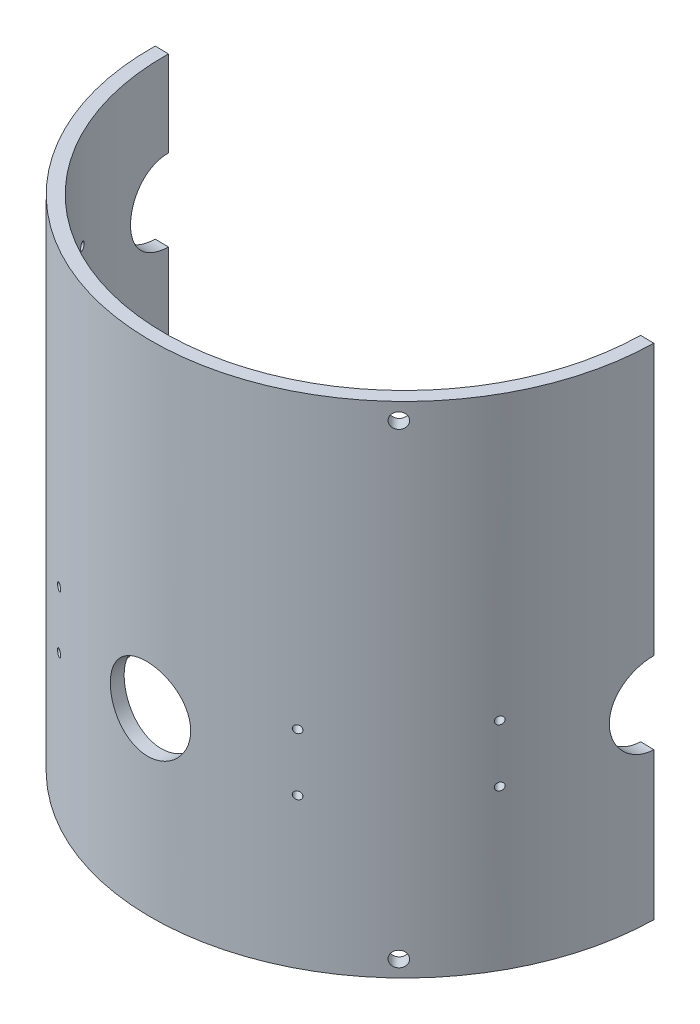
from build123d import *

# Parameters (mm, degrees)
BOSS_EXTRUDE1_DEPTH      = 130.8
SKETCH5_R                = 10.65
CUT_EXTRUDE4_DEPTH       = 129.8
SKETCH6_R                = 10.65
CUT_EXTRUDE5_DEPTH       = 129.8
SKETCH57_R               = 10.7
CUT_EXTRUDE48_DEPTH      = 148.089829044
CUT_EXTRUDE51_DEPTH      = 132.35522197
CUT_EXTRUDE51_DEPTH_BACK = 132.35522197
SKETCH60_R               = 2
CUT_EXTRUDE52_DEPTH      = 132.574432074
CUT_EXTRUDE52_DEPTH_BACK = 132.574432074
SKETCH61_R               = 2.000000001
SKETCH63_R               = 1
CUT_EXTRUDE53_DEPTH      = 155.429604817
SKETCH64_R               = 1
CUT_EXTRUDE54_DEPTH      = 157.678735431
SKETCH65_R               = 1
CUT_EXTRUDE55_DEPTH      = 157.678735431
SKETCH66_R               = 1
CUT_EXTRUDE56_DEPTH      = 155.429604817


with BuildPart() as part:
    # Sketch1 → Boss-Extrude1 (new body)
    with BuildSketch(Plane(origin=(0, 0, 0), x_dir=(0.999872775920664, 0, 0.01595092388251422), z_dir=(0, 1, 0))):
        with BuildLine():
            Line((70.372282363, 4.818066557), (66.856282363, 4.818066557))
            ThreePointArc((66.856282363, 4.818066557), (4.002282363, -58.035933443), (-58.851717637, 4.818066557))
            Line((-58.851717637, 4.818066557), (-62.367717637, 4.818066557))
            ThreePointArc((-62.367717637, 4.818066557), (4.002282363, -61.551933443), (70.372282363, 4.818066557))
        make_face()
    extrude(amount=BOSS_EXTRUDE1_DEPTH)

    # Sketch5 → Cut-Extrude4 (cut)
    with BuildSketch(Plane(origin=(63.687908888, 47.899932993, -8.621348971), x_dir=(0.015950923882504298, 0, -0.9998727759206641), z_dir=(0.9998727759206643, 0, 0.015950923882504298))):
        with Locations((-4.818066557, 1.350067007)):
            Circle(SKETCH5_R)
    extrude(amount=CUT_EXTRUDE4_DEPTH, mode=Mode.SUBTRACT)

    # Sketch6 → Cut-Extrude5 (cut)
    with BuildSketch(Plane(origin=(-55.376952084, 47.899932993, -10.520785159), x_dir=(-0.01595092388248271, 0, 0.9998727759206645), z_dir=(-0.9998727759206645, 0, -0.01595092388248271))):
        with Locations((4.818066557, 49.750067007)):
            Circle(SKETCH6_R)
    extrude(amount=CUT_EXTRUDE5_DEPTH, mode=Mode.SUBTRACT)

    # Sketch57 → Cut-Extrude48 (cut, through all)
    with BuildSketch(Plane(origin=(-1.337515808, 38.899932993, 83.841265458), x_dir=(0.999872775920664, 0, 0.015950923882512152), z_dir=(-0.015950923882512152, 0, 0.999872775920664))):
        with Locations((4.002282363, 7.900067007)):
            Circle(SKETCH57_R)
    extrude(amount=-CUT_EXTRUDE48_DEPTH, mode=Mode.SUBTRACT)

    # Sketch60 → Cut-Extrude51 (cut, two sides: drawn at the far end of the back side and taken through both)
    with BuildSketch(Plane(origin=(4.479542792, 38.899932993, -4.33978545), x_dir=(0.6958141043149662, 0, 0.7182219240850013), z_dir=(-0.7182219240850013, 0, 0.6958141043149662)).offset(-CUT_EXTRUDE51_DEPTH_BACK)):
        with Locations((-0.576184071, 87.550067007)):
            Circle(SKETCH60_R)
        with Locations((-0.576184071, -34.599932993)):
            Circle(SKETCH60_R)
    extrude(amount=CUT_EXTRUDE51_DEPTH + CUT_EXTRUDE51_DEPTH_BACK, mode=Mode.SUBTRACT)

    # Sketch61 → Cut-Extrude52 (cut, two sides: drawn at the far end of the back side and taken through both)
    with BuildSketch(Plane(origin=(-0.400917003, 38.899932993, -0.413828032), x_dir=(0.7182219240850013, 0, -0.6958141043149662), z_dir=(0.6958141043149662, 0, 0.7182219240850013)).offset(-CUT_EXTRUDE52_DEPTH_BACK)):
        with Locations((6.236989769, 87.550067007)):
            Circle(SKETCH61_R)
        with Locations((6.236989769, -34.599932997)):
            Circle(SKETCH61_R)
    extrude(amount=CUT_EXTRUDE52_DEPTH + CUT_EXTRUDE52_DEPTH_BACK, mode=Mode.SUBTRACT)

    # Sketch63 → Cut-Extrude53 (cut, through all)
    with BuildSketch(Plane(origin=(48.51495843, 38.899932993, 50.087966302), x_dir=(0.718295826620825, 0, -0.6957378137338129), z_dir=(0.6957378137338129, 0, 0.718295826620825))):
        with Locations((-12.551102324, 15.400067007)):
            Circle(SKETCH63_R)
        with Locations((-12.551102324, 0.400067007)):
            Circle(SKETCH63_R)
    extrude(amount=-CUT_EXTRUDE53_DEPTH, mode=Mode.SUBTRACT)

    # Sketch64 → Cut-Extrude54 (cut, through all)
    with BuildSketch(Plane(origin=(-46.022353024, 38.899932993, 44.577025355), x_dir=(0.6957378137337953, 0, 0.7182958266208421), z_dir=(-0.7182958266208421, 0, 0.6957378137337953))):
        with Locations((18.069559284, 15.400067007)):
            Circle(SKETCH64_R)
        with Locations((18.069559284, 0.400067007)):
            Circle(SKETCH64_R)
    extrude(amount=-CUT_EXTRUDE54_DEPTH, mode=Mode.SUBTRACT)

    # Sketch65 → Cut-Extrude55 (cut, through all)
    with BuildSketch(Plane(origin=(-46.022353024, 38.899932993, 44.577025355), x_dir=(0.6957378137338341, 0, 0.7182958266208045), z_dir=(-0.7182958266208045, 0, 0.6957378137338341))):
        with Locations((-19.364877393, 66.250067007)):
            Circle(SKETCH65_R)
        with Locations((-19.364877393, 51.250067007)):
            Circle(SKETCH65_R)
    extrude(amount=-CUT_EXTRUDE55_DEPTH, mode=Mode.SUBTRACT)

    # Sketch66 → Cut-Extrude56 (cut, through all)
    with BuildSketch(Plane(origin=(48.51495843, 38.899932993, 50.087966302), x_dir=(0.7182958266208437, 0, -0.6957378137337936), z_dir=(0.6957378137337936, 0, 0.7182958266208437))):
        with Locations((24.883334353, 17.850067007)):
            Circle(SKETCH66_R)
        with Locations((24.883334353, 2.850067007)):
            Circle(SKETCH66_R)
    extrude(amount=-CUT_EXTRUDE56_DEPTH, mode=Mode.SUBTRACT)


solid = part.part
